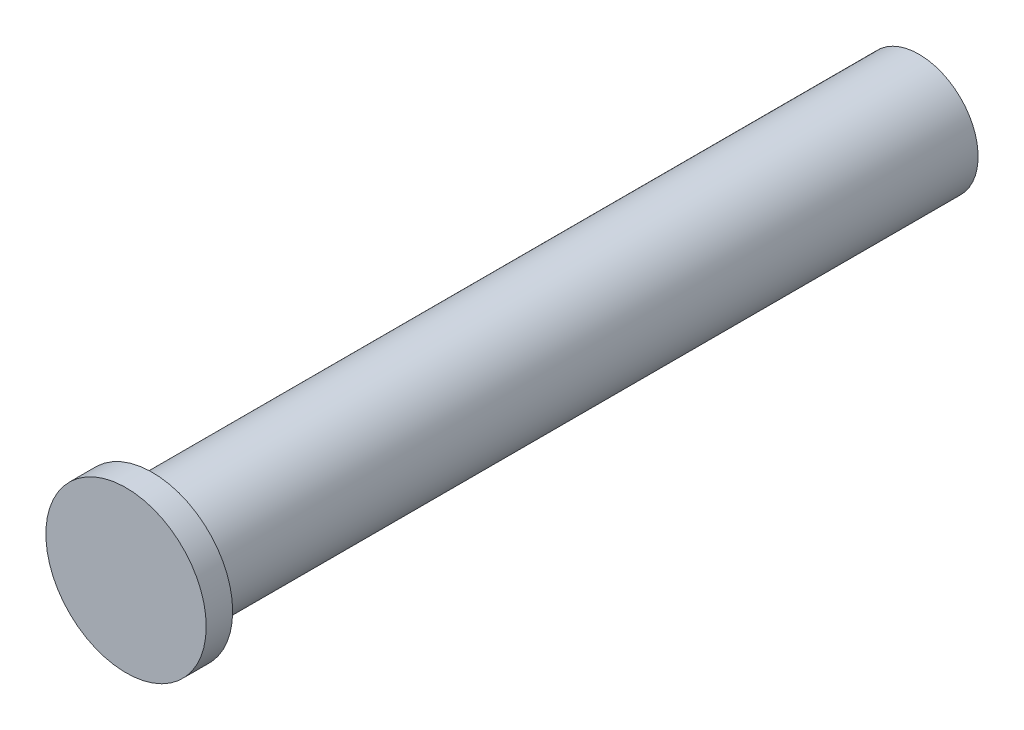
from build123d import *

# Parameters (mm, degrees)
ESBO_O1_R                 = 9.1
RESSALTO_EXTRUS_O1_DEPTH  = 3
ESBO_O2_R                 = 6.7
RESSALTO_EXTRUS_O2_DEPTH  = 87
FURO_ROSCADO_DE_M21_D     = 1.6
FURO_ROSCADO_DE_M21_DEPTH = 10
FURO_ROSCADO_DE_M21_TIP   = 0.480688495


with BuildPart() as part:
    # Esboço1 → Ressalto-extrusão1 (new body)
    with BuildSketch(Plane.XY):
        Circle(ESBO_O1_R)
    extrude(amount=-RESSALTO_EXTRUS_O1_DEPTH)

    # Esboço2 → Ressalto-extrusão2 (add)
    with BuildSketch(Plane(origin=(0, 0, -3), x_dir=(-1, 0, 0), z_dir=(0, 0, -1))):
        Circle(ESBO_O2_R)
    extrude(amount=RESSALTO_EXTRUS_O2_DEPTH)

    # Furo roscado de M21
    with Locations(Plane(origin=(0, 0, -90), x_dir=(-1, 0, 0), z_dir=(0, 0, -1))):
        with Locations((-2.598076211, -1.5), (0, 3), (2.598076211, -1.5)):
            Hole(FURO_ROSCADO_DE_M21_D / 2, depth=FURO_ROSCADO_DE_M21_DEPTH)
            with Locations((0, 0, -(FURO_ROSCADO_DE_M21_DEPTH + FURO_ROSCADO_DE_M21_TIP / 2))):  # 118° drill point
                Cone(0, FURO_ROSCADO_DE_M21_D / 2, FURO_ROSCADO_DE_M21_TIP, mode=Mode.SUBTRACT)


solid = part.part
